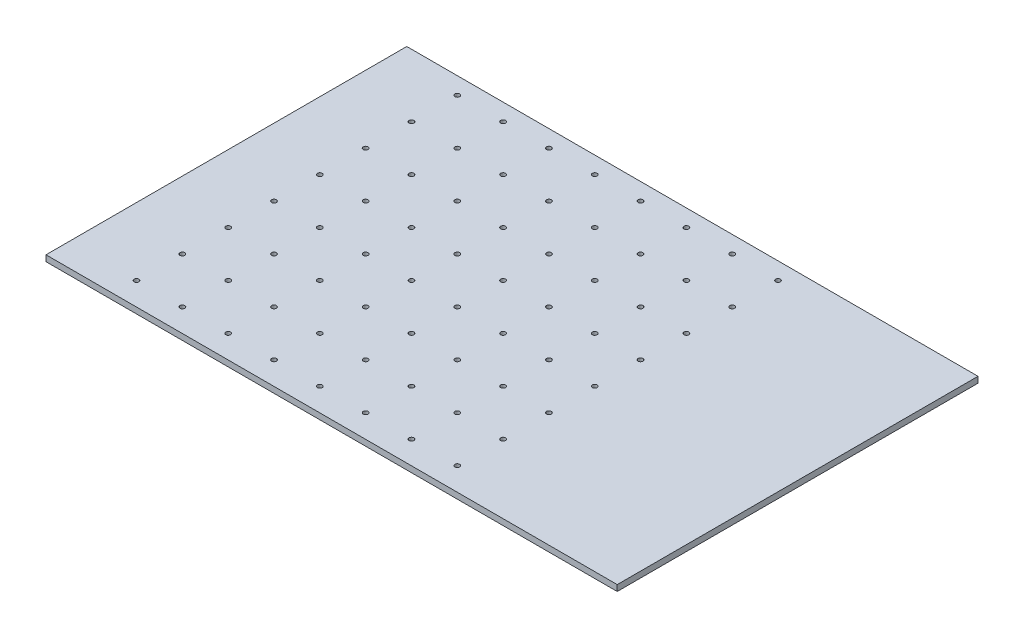
from build123d import *

# Parameters (mm, degrees)
SKETCH1_W           = 950
SKETCH1_H           = 600
BOSS_EXTRUDE1_DEPTH = 10
SKETCH2_R           = 4
CUT_EXTRUDE1_DEPTH  = 10


with BuildPart() as part:
    # Sketch1 → Boss-Extrude1 (new body)
    with BuildSketch(Plane(origin=(0, 0, 0), x_dir=(1, 0, 0), z_dir=(0, 1, 0))):
        Rectangle(SKETCH1_W, SKETCH1_H)
    extrude(amount=BOSS_EXTRUDE1_DEPTH)

    # Sketch2 → Cut-Extrude1 (cut)
    with BuildSketch(Plane(origin=(0, 10, 0), x_dir=(1, 0, 0), z_dir=(0, 1, 0))):
        with Locations(Location((-362.7, 271.7, 0), (0, 0, 270))):
            Circle(SKETCH2_R)
        with Locations(Location((-286.5, 271.7, 0), (0, 0, 270))):
            Circle(SKETCH2_R)
        with Locations(Location((-210.3, 271.7, 0), (0, 0, 270))):
            Circle(SKETCH2_R)
        with Locations(Location((-134.1, 271.7, 0), (0, 0, 270))):
            Circle(SKETCH2_R)
        with Locations(Location((-57.9, 271.7, 0), (0, 0, 270))):
            Circle(SKETCH2_R)
        with Locations(Location((18.3, 271.7, 0), (0, 0, 270))):
            Circle(SKETCH2_R)
        with Locations(Location((94.5, 271.7, 0), (0, 0, 270))):
            Circle(SKETCH2_R)
        with Locations(Location((170.7, 271.7, 0), (0, 0, 270))):
            Circle(SKETCH2_R)
        with Locations(Location((-362.7, 195.5, 0), (0, 0, 270))):
            Circle(SKETCH2_R)
        with Locations(Location((-286.5, 195.5, 0), (0, 0, 270))):
            Circle(SKETCH2_R)
        with Locations(Location((-210.3, 195.5, 0), (0, 0, 270))):
            Circle(SKETCH2_R)
        with Locations(Location((-134.1, 195.5, 0), (0, 0, 270))):
            Circle(SKETCH2_R)
        with Locations(Location((18.3, 195.5, 0), (0, 0, 270))):
            Circle(SKETCH2_R)
        with Locations(Location((-57.9, 195.5, 0), (0, 0, 270))):
            Circle(SKETCH2_R)
        with Locations(Location((94.5, 195.5, 0), (0, 0, 270))):
            Circle(SKETCH2_R)
        with Locations(Location((170.7, 195.5, 0), (0, 0, 270))):
            Circle(SKETCH2_R)
        with Locations(Location((-362.7, 119.3, 0), (0, 0, 270))):
            Circle(SKETCH2_R)
        with Locations(Location((-286.5, 119.3, 0), (0, 0, 270))):
            Circle(SKETCH2_R)
        with Locations(Location((-210.3, 119.3, 0), (0, 0, 270))):
            Circle(SKETCH2_R)
        with Locations(Location((-134.1, 119.3, 0), (0, 0, 270))):
            Circle(SKETCH2_R)
        with Locations(Location((18.3, 119.3, 0), (0, 0, 270))):
            Circle(SKETCH2_R)
        with Locations(Location((-57.9, 119.3, 0), (0, 0, 270))):
            Circle(SKETCH2_R)
        with Locations(Location((94.5, 119.3, 0), (0, 0, 270))):
            Circle(SKETCH2_R)
        with Locations(Location((170.7, 119.3, 0), (0, 0, 270))):
            Circle(SKETCH2_R)
        with Locations(Location((-362.7, 43.1, 0), (0, 0, 270))):
            Circle(SKETCH2_R)
        with Locations(Location((-286.5, 43.1, 0), (0, 0, 270))):
            Circle(SKETCH2_R)
        with Locations(Location((-210.3, 43.1, 0), (0, 0, 270))):
            Circle(SKETCH2_R)
        with Locations(Location((-134.1, 43.1, 0), (0, 0, 270))):
            Circle(SKETCH2_R)
        with Locations(Location((18.3, 43.1, 0), (0, 0, 270))):
            Circle(SKETCH2_R)
        with Locations(Location((-57.9, 43.1, 0), (0, 0, 270))):
            Circle(SKETCH2_R)
        with Locations(Location((94.5, 43.1, 0), (0, 0, 270))):
            Circle(SKETCH2_R)
        with Locations(Location((170.7, 43.1, 0), (0, 0, 270))):
            Circle(SKETCH2_R)
        with Locations(Location((-362.7, -33.1, 0), (0, 0, 270))):
            Circle(SKETCH2_R)
        with Locations(Location((-286.5, -33.1, 0), (0, 0, 270))):
            Circle(SKETCH2_R)
        with Locations(Location((-210.3, -33.1, 0), (0, 0, 270))):
            Circle(SKETCH2_R)
        with Locations(Location((-134.1, -33.1, 0), (0, 0, 270))):
            Circle(SKETCH2_R)
        with Locations(Location((18.3, -33.1, 0), (0, 0, 270))):
            Circle(SKETCH2_R)
        with Locations(Location((-57.9, -33.1, 0), (0, 0, 270))):
            Circle(SKETCH2_R)
        with Locations(Location((94.5, -33.1, 0), (0, 0, 270))):
            Circle(SKETCH2_R)
        with Locations(Location((170.7, -33.1, 0), (0, 0, 270))):
            Circle(SKETCH2_R)
        with Locations(Location((-362.7, -109.3, 0), (0, 0, 270))):
            Circle(SKETCH2_R)
        with Locations(Location((-286.5, -109.3, 0), (0, 0, 270))):
            Circle(SKETCH2_R)
        with Locations(Location((-210.3, -109.3, 0), (0, 0, 270))):
            Circle(SKETCH2_R)
        with Locations(Location((-134.1, -109.3, 0), (0, 0, 270))):
            Circle(SKETCH2_R)
        with Locations(Location((18.3, -109.3, 0), (0, 0, 270))):
            Circle(SKETCH2_R)
        with Locations(Location((-57.9, -109.3, 0), (0, 0, 270))):
            Circle(SKETCH2_R)
        with Locations(Location((94.5, -109.3, 0), (0, 0, 270))):
            Circle(SKETCH2_R)
        with Locations(Location((170.7, -109.3, 0), (0, 0, 270))):
            Circle(SKETCH2_R)
        with Locations(Location((-362.7, -185.5, 0), (0, 0, 270))):
            Circle(SKETCH2_R)
        with Locations(Location((-286.5, -185.5, 0), (0, 0, 270))):
            Circle(SKETCH2_R)
        with Locations(Location((-210.3, -185.5, 0), (0, 0, 270))):
            Circle(SKETCH2_R)
        with Locations(Location((-134.1, -185.5, 0), (0, 0, 270))):
            Circle(SKETCH2_R)
        with Locations(Location((18.3, -185.5, 0), (0, 0, 270))):
            Circle(SKETCH2_R)
        with Locations(Location((-57.9, -185.5, 0), (0, 0, 270))):
            Circle(SKETCH2_R)
        with Locations(Location((94.5, -185.5, 0), (0, 0, 270))):
            Circle(SKETCH2_R)
        with Locations(Location((170.7, -185.5, 0), (0, 0, 270))):
            Circle(SKETCH2_R)
        with Locations(Location((-362.7, -261.7, 0), (0, 0, 270))):
            Circle(SKETCH2_R)
        with Locations(Location((-286.5, -261.7, 0), (0, 0, 270))):
            Circle(SKETCH2_R)
        with Locations(Location((-210.3, -261.7, 0), (0, 0, 270))):
            Circle(SKETCH2_R)
        with Locations(Location((-134.1, -261.7, 0), (0, 0, 270))):
            Circle(SKETCH2_R)
        with Locations(Location((18.3, -261.7, 0), (0, 0, 270))):
            Circle(SKETCH2_R)
        with Locations(Location((-57.9, -261.7, 0), (0, 0, 270))):
            Circle(SKETCH2_R)
        with Locations(Location((94.5, -261.7, 0), (0, 0, 270))):
            Circle(SKETCH2_R)
        with Locations(Location((170.7, -261.7, 0), (0, 0, 270))):
            Circle(SKETCH2_R)
    extrude(amount=-CUT_EXTRUDE1_DEPTH, mode=Mode.SUBTRACT)


solid = part.part
